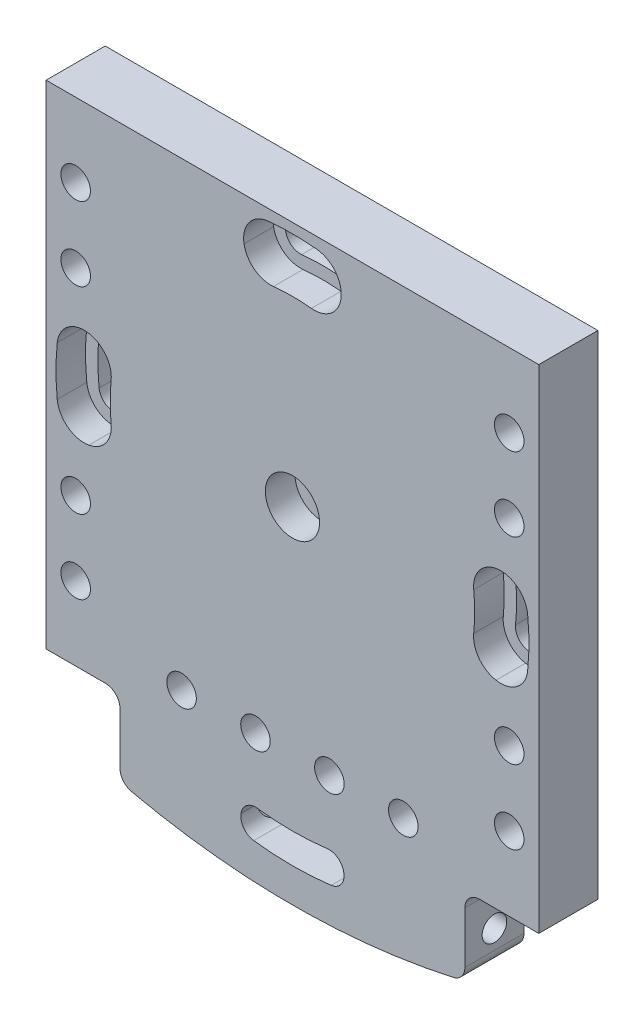
from build123d import *

# Parameters (mm, degrees)
EXTRUDE_1_DEPTH     = 12
SKETCH_2_R          = 2.5
CUT_EXTRUDE_1_DEPTH = 100
SKETCH_4_R          = 5.5
CUT_EXTRUDE_2_DEPTH = 6
SKETCH_5_R          = 3
CUT_EXTRUDE_3_DEPTH = 12
SKETCH_6_R          = 5.5
CUT_EXTRUDE_4_DEPTH = 6
SKETCH_7_R          = 3
CUT_EXTRUDE_5_DEPTH = 12
SKETCH_8_R          = 5.5
CUT_EXTRUDE_6_DEPTH = 6


with BuildPart() as part:
    # 草图1 → 凸台-拉伸1 (new body)
    with BuildSketch(Plane.XY):
        with BuildLine():
            Line((50, 50), (-50, 50))
            Line((-50, 50), (-50, 48.957008554))
            Line((-50, 48.957008554), (-50, -48.957008554))
            Line((-50, -48.957008554), (-50, -50))
            Line((-50, -50), (-37.992045802, -50))
            ThreePointArc((-37.992045802, -50), (-35.876349926, -50.876349926), (-35, -52.992045802))
            Line((-35, -52.992045802), (-35, -63.481111877))
            ThreePointArc((-35, -63.481111877), (-34.342641041, -65.352361573), (-32.659410546, -66.401376028))
            ThreePointArc((-32.659410546, -66.401376028), (0, -70), (32.659410546, -66.401376028))
            ThreePointArc((32.659410546, -66.401376028), (34.342641041, -65.352361573), (35, -63.481111877))
            Line((35, -63.481111877), (35, -52.992045802))
            ThreePointArc((35, -52.992045802), (35.876349926, -50.876349926), (37.992045802, -50))
            Line((37.992045802, -50), (50, -50))
            Line((50, -50), (50, 50))
        make_face()
        with BuildLine():
            Line((-10.424579745, -59.123600509), (-10.403717067, -59.005276638))
            ThreePointArc((-10.403717067, -59.005276638), (-9.234674793, -57.118723847), (-7.087361923, -56.557663504))
            ThreePointArc((-7.087361923, -56.557663504), (0.000473323, -56.999999998), (7.088301222, -56.55754579))
            ThreePointArc((7.088301222, -56.55754579), (9.235623411, -57.118570471), (10.404697016, -59.005103847))
            Line((10.404697016, -59.005103847), (10.425561659, -59.123427371))
            ThreePointArc((10.425561659, -59.123427371), (9.886845106, -61.4180373), (7.853111276, -62.609413376))
            ThreePointArc((7.853111276, -62.609413376), (0.000523977, -63.099999998), (-7.852071468, -62.609543791))
            ThreePointArc((-7.852071468, -62.609543791), (-9.885825084, -61.41820149), (-10.424579745, -59.123600509))
        make_face(mode=Mode.SUBTRACT)
        with BuildLine():
            Line((-41.760493789, 7.363501783), (-41.740748709, 7.360020192))
            ThreePointArc((-41.740748709, 7.360020192), (-39.872589603, 6.215605576), (-39.286144787, 4.104732359))
            ThreePointArc((-39.286144787, 4.104732359), (-39.5, 0), (-39.286144787, -4.104732359))
            ThreePointArc((-39.286144787, -4.104732359), (-39.872589603, -6.215605576), (-41.740748709, -7.360020192))
            Line((-41.740748709, -7.360020192), (-41.760493789, -7.363501783))
            ThreePointArc((-41.760493789, -7.363501783), (-44.079822787, -6.806323631), (-45.253503499, -4.729737952))
            ThreePointArc((-45.253503499, -4.729737952), (-45.5, 0), (-45.253503499, 4.729737952))
            ThreePointArc((-45.253503499, 4.729737952), (-44.079822787, 6.806323631), (-41.760493789, 7.363501783))
        make_face(mode=Mode.SUBTRACT)
        with BuildLine():
            ThreePointArc((0.520969066, -2.954418933), (2.4912e-05, -3), (-0.52092, -2.954427585))
            ThreePointArc((-0.52092, -2.954427585), (-2.121311536, -2.121329151), (-2.954423259, -0.520944533))
            ThreePointArc((-2.954423259, -0.520944533), (-3, 0), (-2.954423259, 0.520944533))
            ThreePointArc((-2.954423259, 0.520944533), (0.261467228, 2.988584094), (3, 0))
            ThreePointArc((3, 0), (2.298141336, -1.928353287), (0.520969066, -2.954418933))
        make_face(mode=Mode.SUBTRACT)
        with BuildLine():
            ThreePointArc((39.286144787, 4.104732359), (39.872589603, 6.215605576), (41.740748709, 7.360020192))
            Line((41.740748709, 7.360020192), (41.760493789, 7.363501783))
            ThreePointArc((41.760493789, 7.363501783), (44.079822787, 6.806323631), (45.253503499, 4.729737952))
            ThreePointArc((45.253503499, 4.729737952), (45.5, 0), (45.253503499, -4.729737952))
            ThreePointArc((45.253503499, -4.729737952), (44.079822787, -6.806323631), (41.760493789, -7.363501783))
            Line((41.760493789, -7.363501783), (41.740748709, -7.360020192))
            ThreePointArc((41.740748709, -7.360020192), (39.872589603, -6.215605576), (39.286144787, -4.104732359))
            ThreePointArc((39.286144787, -4.104732359), (39.5, 0), (39.286144787, 4.104732359))
        make_face(mode=Mode.SUBTRACT)
        with BuildLine():
            ThreePointArc((-4.104732359, 39.286144787), (-6.215605576, 39.872589603), (-7.360020192, 41.740748709))
            Line((-7.360020192, 41.740748709), (-7.363501783, 41.760493789))
            ThreePointArc((-7.363501783, 41.760493789), (-6.806323631, 44.079822787), (-4.729737952, 45.253503499))
            ThreePointArc((-4.729737952, 45.253503499), (0, 45.5), (4.729737952, 45.253503499))
            ThreePointArc((4.729737952, 45.253503499), (6.806323631, 44.079822787), (7.363501783, 41.760493789))
            Line((7.363501783, 41.760493789), (7.360020192, 41.740748709))
            ThreePointArc((7.360020192, 41.740748709), (6.215605576, 39.872589603), (4.104732359, 39.286144787))
            ThreePointArc((4.104732359, 39.286144787), (0, 39.5), (-4.104732359, 39.286144787))
        make_face(mode=Mode.SUBTRACT)
    extrude(amount=EXTRUDE_1_DEPTH)

    # 草图2 → 切除-拉伸1 (cut)
    with BuildSketch(Plane.ZY.offset(35)):
        with Locations((6, -59.592045802)):
            Circle(SKETCH_2_R)
    extrude(amount=-CUT_EXTRUDE_1_DEPTH, mode=Mode.SUBTRACT)

    # 草图4 → 切除-拉伸2 (cut)
    with BuildSketch(Plane.XY.offset(12)):
        Circle(SKETCH_4_R)
        with BuildLine():
            Line((-9.825521165, 41.326373345), (-9.822039575, 41.306628265))
            ThreePointArc((-9.822039575, 41.306628265), (-7.720756549, 37.876463218), (-3.844939172, 36.799679928))
            ThreePointArc((-3.844939172, 36.799679928), (0, 37), (3.844939172, 36.799679928))
            ThreePointArc((3.844939172, 36.799679928), (7.720756549, 37.876463218), (9.822039575, 41.306628265))
            Line((9.822039575, 41.306628265), (9.825521165, 41.326373345))
            ThreePointArc((9.825521165, 41.326373345), (8.802474993, 45.584940635), (4.989613664, 47.739959735))
            ThreePointArc((4.989613664, 47.739959735), (0, 48), (-4.989613664, 47.739959735))
            ThreePointArc((-4.989613664, 47.739959735), (-8.802474993, 45.584940635), (-9.825521165, 41.326373345))
        make_face()
        with BuildLine():
            Line((-41.326373345, -9.825521165), (-41.306628265, -9.822039575))
            ThreePointArc((-41.306628265, -9.822039575), (-37.876463218, -7.720756549), (-36.799679928, -3.844939172))
            ThreePointArc((-36.799679928, -3.844939172), (-37, 0), (-36.799679928, 3.844939172))
            ThreePointArc((-36.799679928, 3.844939172), (-37.876463218, 7.720756549), (-41.306628265, 9.822039575))
            Line((-41.306628265, 9.822039575), (-41.326373345, 9.825521165))
            ThreePointArc((-41.326373345, 9.825521165), (-45.584940635, 8.802474993), (-47.739959735, 4.989613664))
            ThreePointArc((-47.739959735, 4.989613664), (-48, 0), (-47.739959735, -4.989613664))
            ThreePointArc((-47.739959735, -4.989613664), (-45.584940635, -8.802474993), (-41.326373345, -9.825521165))
        make_face()
        with BuildLine():
            Line((41.326373345, 9.825521165), (41.306628265, 9.822039575))
            ThreePointArc((41.306628265, 9.822039575), (37.876463218, 7.720756549), (36.799679928, 3.844939172))
            ThreePointArc((36.799679928, 3.844939172), (37, 0), (36.799679928, -3.844939172))
            ThreePointArc((36.799679928, -3.844939172), (37.876463218, -7.720756549), (41.306628265, -9.822039575))
            Line((41.306628265, -9.822039575), (41.326373345, -9.825521165))
            ThreePointArc((41.326373345, -9.825521165), (45.584940635, -8.802474993), (47.739959735, -4.989613664))
            ThreePointArc((47.739959735, -4.989613664), (48, 0), (47.739959735, 4.989613664))
            ThreePointArc((47.739959735, 4.989613664), (45.584940635, 8.802474993), (41.326373345, 9.825521165))
        make_face()
    extrude(amount=-CUT_EXTRUDE_2_DEPTH, mode=Mode.SUBTRACT)

    # 草图5 → 切除-拉伸3 (cut)
    with BuildSketch(Plane(origin=(0, 0, 0), x_dir=(-1, 0, 0), z_dir=(0, 0, -1))):
        with Locations((44, -35)):
            Circle(SKETCH_5_R)
        with Locations((44, -20)):
            Circle(SKETCH_5_R)
        with Locations(Location((44, 35, 0), (0, 0, 180))):
            Circle(SKETCH_5_R)
        with Locations(Location((44, 20, 0), (0, 0, 180))):
            Circle(SKETCH_5_R)
        with Locations((-44, 20)):
            Circle(SKETCH_5_R)
        with Locations((-44, 35)):
            Circle(SKETCH_5_R)
        with Locations(Location((-44, -20, 0), (0, 0, 180))):
            Circle(SKETCH_5_R)
        with Locations(Location((-44, -35, 0), (0, 0, 180))):
            Circle(SKETCH_5_R)
    extrude(amount=-CUT_EXTRUDE_3_DEPTH, mode=Mode.SUBTRACT)

    # 草图6 → 切除-拉伸4 (cut)
    with BuildSketch(Plane(origin=(0, 0, 0), x_dir=(-1, 0, 0), z_dir=(0, 0, -1))):
        with Locations((44, -35)):
            Circle(SKETCH_6_R)
        with Locations(Location((44, 20, 0), (0, 0, 180))):
            Circle(SKETCH_6_R)
        with Locations((44, -20)):
            Circle(SKETCH_6_R)
        with Locations(Location((44, 35, 0), (0, 0, 180))):
            Circle(SKETCH_6_R)
        with Locations((-44, 35)):
            Circle(SKETCH_6_R)
        with Locations(Location((-44, -20, 0), (0, 0, 180))):
            Circle(SKETCH_6_R)
        with Locations((-44, 20)):
            Circle(SKETCH_6_R)
        with Locations(Location((-44, -35, 0), (0, 0, 180))):
            Circle(SKETCH_6_R)
    extrude(amount=-CUT_EXTRUDE_4_DEPTH, mode=Mode.SUBTRACT)

    # 草图7 → 切除-拉伸5 (cut)
    with BuildSketch(Plane(origin=(0, 0, 0), x_dir=(-1, 0, 0), z_dir=(0, 0, -1))):
        with Locations((22.5, -43.493390034)):
            Circle(SKETCH_7_R)
        with Locations((7.5, -43.493390034)):
            Circle(SKETCH_7_R)
        with Locations((-7.5, -43.493390034)):
            Circle(SKETCH_7_R)
        with Locations((-22.5, -43.493390034)):
            Circle(SKETCH_7_R)
    extrude(amount=-CUT_EXTRUDE_5_DEPTH, mode=Mode.SUBTRACT)

    # 草图8 → 切除-拉伸6 (cut)
    with BuildSketch(Plane(origin=(0, 0, 0), x_dir=(-1, 0, 0), z_dir=(0, 0, -1))):
        with Locations((7.5, -43.493390034)):
            Circle(SKETCH_8_R)
        with Locations((22.5, -43.493390034)):
            Circle(SKETCH_8_R)
        with Locations((-7.5, -43.493390034)):
            Circle(SKETCH_8_R)
        with Locations((-22.5, -43.493390034)):
            Circle(SKETCH_8_R)
    extrude(amount=-CUT_EXTRUDE_6_DEPTH, mode=Mode.SUBTRACT)


solid = part.part
